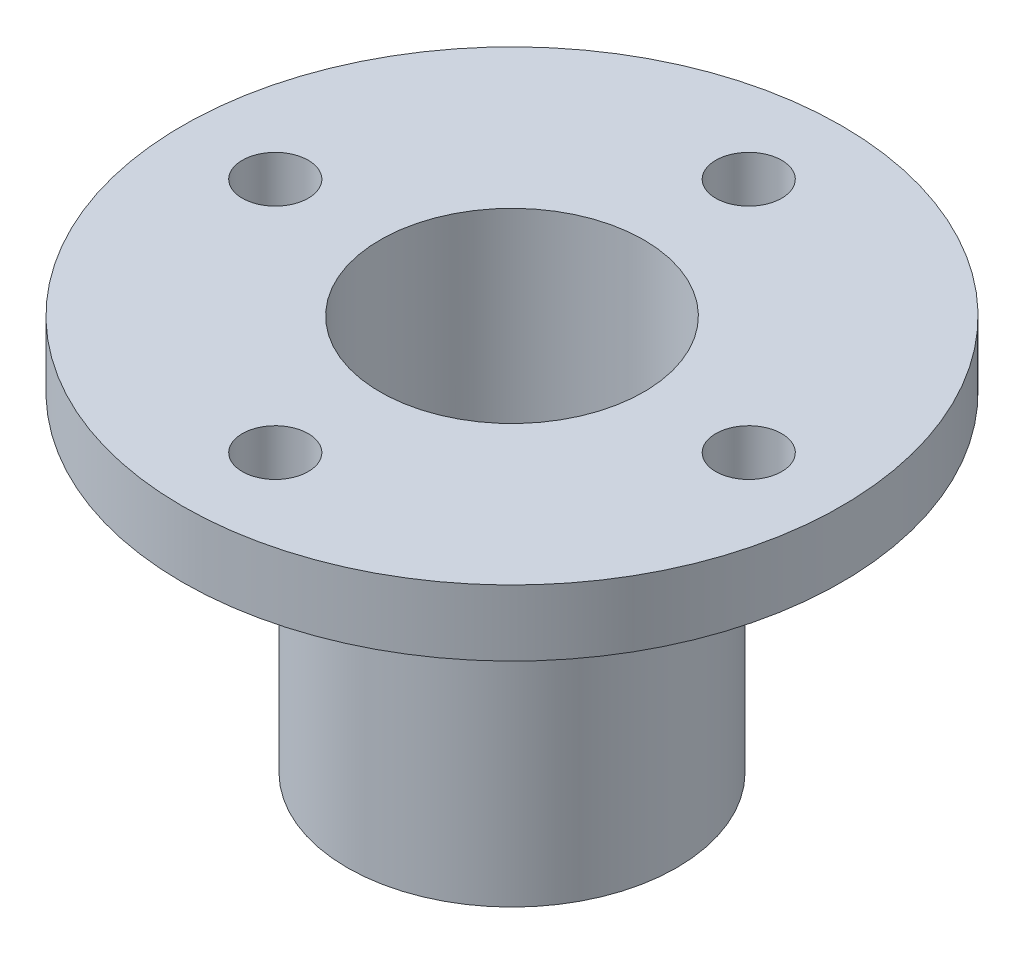
from build123d import *

# Parameters (mm, degrees)
SKETCH1_R           = 5
SKETCH1_R_2         = 4
BOSS_EXTRUDE1_DEPTH = 10
SKETCH2_R           = 10
BOSS_EXTRUDE2_DEPTH = 2
SKETCH3_R           = 1
CUT_EXTRUDE1_DEPTH  = 2
SKETCH4_R           = 4
CUT_EXTRUDE2_DEPTH  = 2


with BuildPart() as part:
    # Sketch1 → Boss-Extrude1 (new body)
    with BuildSketch(Plane(origin=(0, 0, 0), x_dir=(1, 0, 0), z_dir=(0, 1, 0))):
        with Locations(Location((0, 0, 0), (0, 0, 270))):
            Circle(SKETCH1_R)
        with Locations(Location((0, 0, 0), (0, 0, 270))):
            Circle(SKETCH1_R_2, mode=Mode.SUBTRACT)
    extrude(amount=BOSS_EXTRUDE1_DEPTH)

    # Sketch2 → Boss-Extrude2 (add)
    with BuildSketch(Plane(origin=(0, 10, 0), x_dir=(1, 0, 0), z_dir=(0, 1, 0))):
        with Locations(Location((0, 0, 0), (0, 0, 270))):
            Circle(SKETCH2_R)
    extrude(amount=BOSS_EXTRUDE2_DEPTH)

    # Sketch3 → Cut-Extrude1 (cut)
    with BuildSketch(Plane(origin=(0, 10, 0), x_dir=(-1, 0, 0), z_dir=(0, -1, 0))):
        with Locations(Location((-7.183252609, 0, 0), (0, 0, 90))):
            Circle(SKETCH3_R)
        with Locations(Location((0, 7.183252609, 0), (0, 0, 90))):
            Circle(SKETCH3_R)
        with Locations(Location((7.183252609, 0, 0), (0, 0, 90))):
            Circle(SKETCH3_R)
        with Locations(Location((0, -7.183252609, 0), (0, 0, 90))):
            Circle(SKETCH3_R)
    extrude(amount=-CUT_EXTRUDE1_DEPTH, mode=Mode.SUBTRACT)

    # Sketch4 → Cut-Extrude2 (cut)
    with BuildSketch(Plane(origin=(0, 10, 0), x_dir=(-1, 0, 0), z_dir=(0, -1, 0))):
        with Locations(Location((0, 0, 0), (0, 0, 90))):
            Circle(SKETCH4_R)
    extrude(amount=-CUT_EXTRUDE2_DEPTH, mode=Mode.SUBTRACT)


solid = part.part
